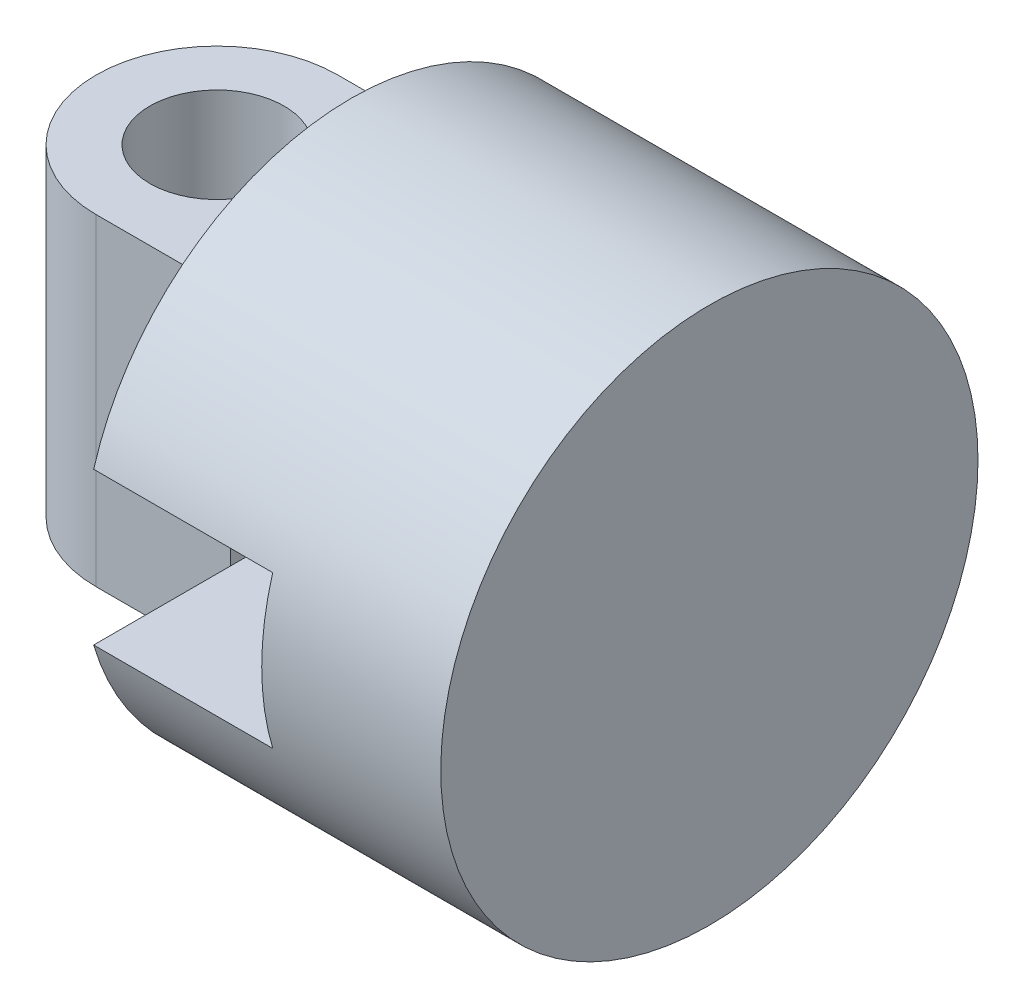
from build123d import *

# Parameters (mm, degrees)
SKETCH_1_R               = 30
EXTRUDE_1_DEPTH          = 40
EXTRUDE_2_DEPTH          = 18
EXTRUDE_2_DEPTH_BACK     = 18
SKETCH_2_R               = 7.5
CUT_EXTRUDE_1_DEPTH      = 59.309518948
CUT_EXTRUDE_1_DEPTH_BACK = 59.309518948
SKETCH_3_W               = 20
SKETCH_3_H               = 17


with BuildPart() as part:
    # Эскиз1 → Бобышка-Вытянуть1 (new body)
    with BuildSketch(Plane(origin=(0, 0, 0), x_dir=(0, 0, -1), z_dir=(1, 0, 0))):
        Circle(SKETCH_1_R)
    extrude(amount=EXTRUDE_1_DEPTH)

    # Эскиз2 → Бобышка-Вытянуть2 (add, two sides: drawn at the far end of the back side and taken through both)
    with BuildSketch(Plane(origin=(0, 0, 0), x_dir=(1, 0, 0), z_dir=(0, 1, 0)).offset(-EXTRUDE_2_DEPTH_BACK)):
        with BuildLine():
            Line((0, 13.5), (-15, 13.5))
            ThreePointArc((-15, 13.5), (-28.5, 0), (-15, -13.5))
            Line((-15, -13.5), (0, -13.5))
            Line((0, -13.5), (0, 13.5))
        make_face()
        with Locations((-15, 0)):
            Circle(SKETCH_2_R, mode=Mode.SUBTRACT)
    extrude(amount=EXTRUDE_2_DEPTH + EXTRUDE_2_DEPTH_BACK)

    # Эскиз3 → Вырез-Вытянуть1 (cut, two sides: drawn at the far end of the back side and taken through both)
    with BuildSketch(Plane.XY.offset(-CUT_EXTRUDE_1_DEPTH_BACK)):
        with Locations((10, 0)):
            Rectangle(SKETCH_3_W, SKETCH_3_H)
    extrude(amount=CUT_EXTRUDE_1_DEPTH + CUT_EXTRUDE_1_DEPTH_BACK, mode=Mode.SUBTRACT)


solid = part.part
